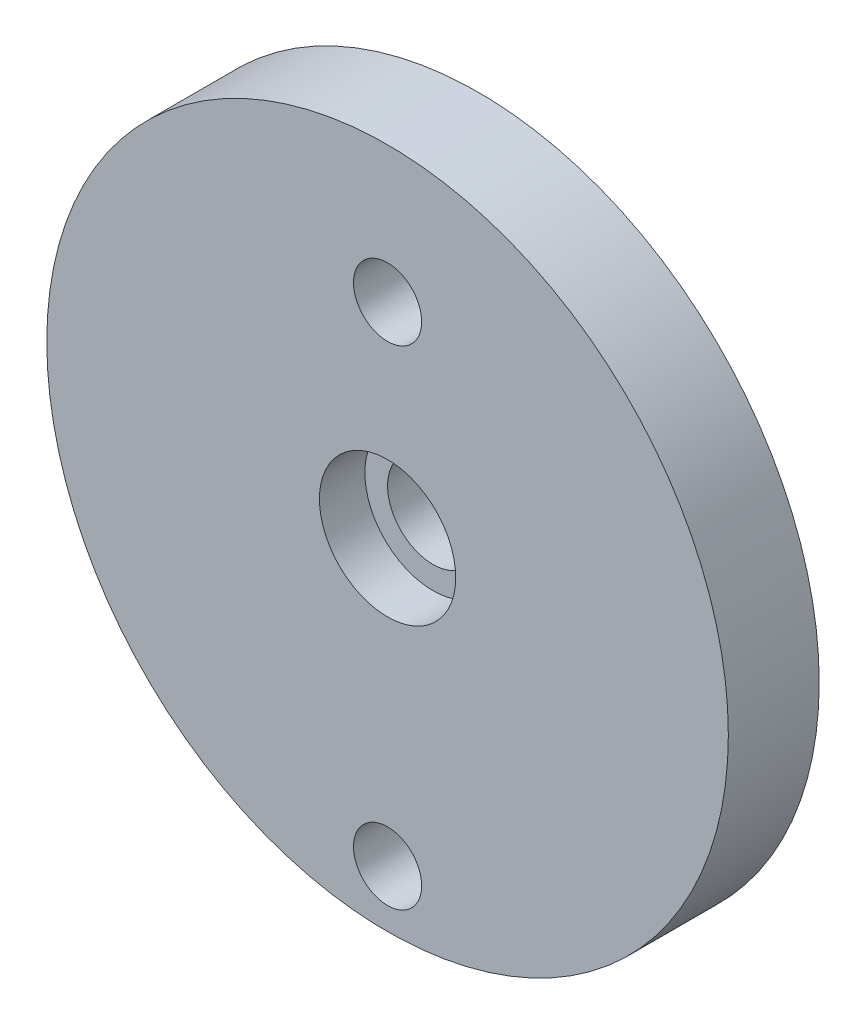
from build123d import *

# Parameters (mm, degrees)
SKETCH1_R           = 15
SKETCH1_R_2         = 1.5
SKETCH1_R_3         = 3
BOSS_EXTRUDE1_DEPTH = 4
SKETCH1_3_R         = 3
SKETCH1_3_R_2       = 2
BOSS_EXTRUDE2_DEPTH = 2


with BuildPart() as part:
    # Sketch1 → Boss-Extrude1 (new body)
    with BuildSketch(Plane.XY):
        Circle(SKETCH1_R)
        with Locations((0, -12.5)):
            Circle(SKETCH1_R_2, mode=Mode.SUBTRACT)
        Circle(SKETCH1_R_3, mode=Mode.SUBTRACT)
        with Locations((0, 9)):
            Circle(SKETCH1_R_2, mode=Mode.SUBTRACT)
    extrude(amount=BOSS_EXTRUDE1_DEPTH)

    # Sketch1<3> → Boss-Extrude2 (add)
    with BuildSketch(Plane.XY):
        Circle(SKETCH1_3_R)
        Circle(SKETCH1_3_R_2, mode=Mode.SUBTRACT)
    extrude(amount=BOSS_EXTRUDE2_DEPTH)


solid = part.part
